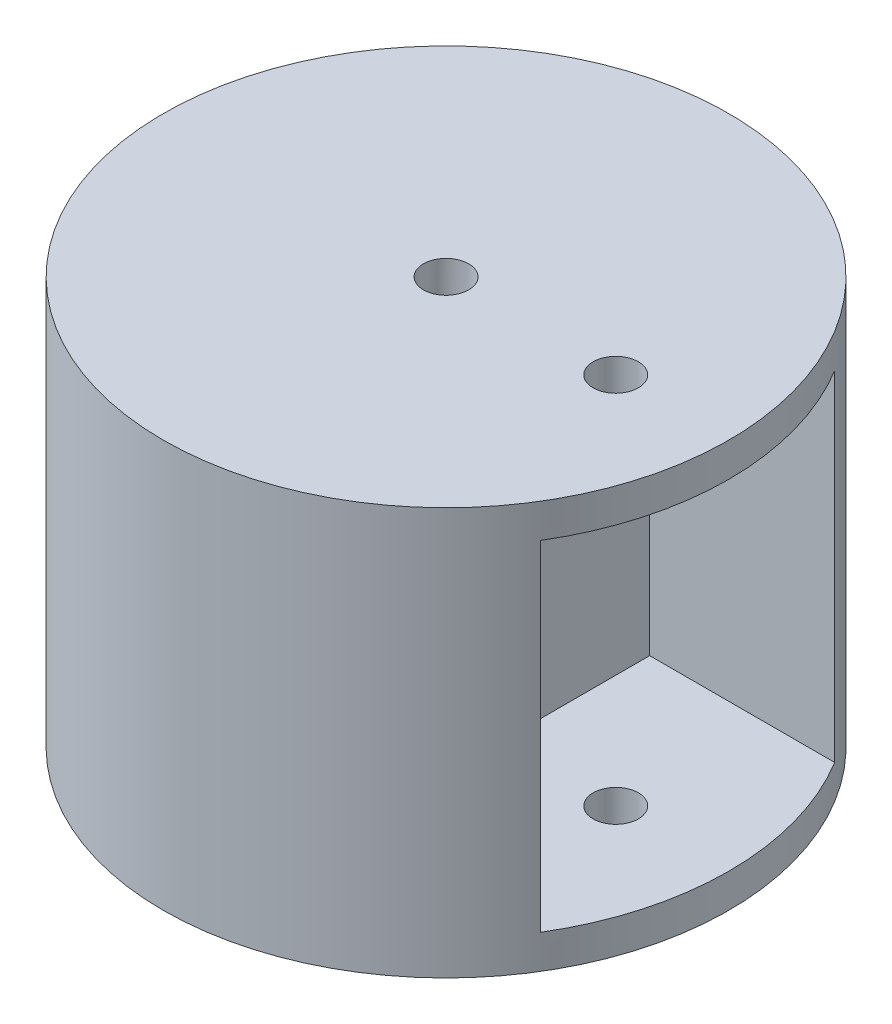
from build123d import *

# Parameters (mm, degrees)
SKETCH1_R           = 12.5
BOSS_EXTRUDE1_DEPTH = 18
SKETCH3_R           = 1
CUT_EXTRUDE2_DEPTH  = 26.228951623
SKETCH6_W           = 13
SKETCH6_H           = 15
CUT_EXTRUDE3_DEPTH  = 10
CUT_EXTRUDE4_DEPTH  = 16
SKETCH7_R           = 1
CUT_EXTRUDE5_DEPTH  = 16


with BuildPart() as part:
    # Sketch1 → Boss-Extrude1 (new body)
    with BuildSketch(Plane(origin=(0, 0, 0), x_dir=(1, 0, 0), z_dir=(0, 1, 0))):
        with Locations(Location((0, 0, 0), (0, 0, 270))):
            Circle(SKETCH1_R)
    extrude(amount=BOSS_EXTRUDE1_DEPTH)

    # Sketch3 → Cut-Extrude2 (cut, through all)
    with BuildSketch(Plane.XZ):
        with Locations(Location((7.5, 0, 0), (0, 0, 270))):
            Circle(SKETCH3_R)
    extrude(amount=-CUT_EXTRUDE2_DEPTH, mode=Mode.SUBTRACT)

    # Sketch6 → Cut-Extrude3 (cut)
    with BuildSketch(Plane(origin=(12.5, 0, 0), x_dir=(0, 0, -1), z_dir=(1, 0, 0))):
        with Locations((0, 9)):
            Rectangle(SKETCH6_W, SKETCH6_H)
    extrude(amount=-CUT_EXTRUDE3_DEPTH, mode=Mode.SUBTRACT)

    # Sketch5 → Cut-Extrude4 (cut)
    with BuildSketch(Plane.XZ):
        with BuildLine():
            Line((-1.414213562, 0.5), (-2.514213562, 0.5))
            Line((-2.514213562, 0.5), (-2.514213562, -0.5))
            Line((-2.514213562, -0.5), (-1.414213562, -0.5))
            ThreePointArc((-1.414213562, -0.5), (1.5, 0), (-1.414213562, 0.5))
        make_face()
    extrude(amount=-CUT_EXTRUDE4_DEPTH, mode=Mode.SUBTRACT)

    # Sketch7 → Cut-Extrude5 (cut)
    with BuildSketch(Plane(origin=(0, 18, 0), x_dir=(1, 0, 0), z_dir=(0, 1, 0))):
        with Locations(Location((0, 0, 0), (0, 0, 270))):
            Circle(SKETCH7_R)
    extrude(amount=-CUT_EXTRUDE5_DEPTH, mode=Mode.SUBTRACT)


solid = part.part
